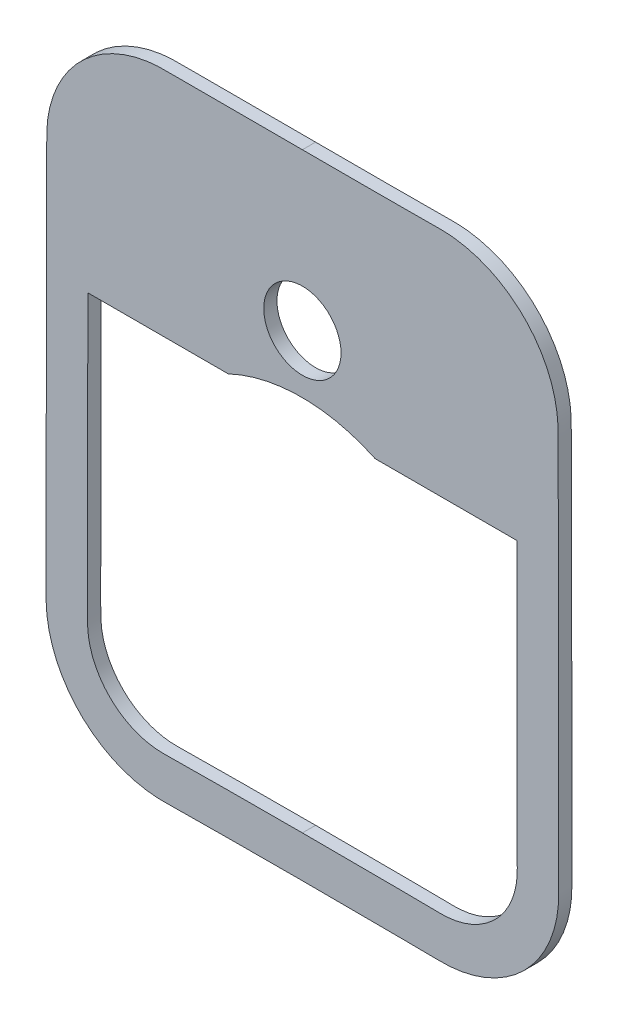
from build123d import *

# Parameters (mm, degrees)
SKETCH_1_R      = 8.2
EXTRUDE_1_DEPTH = 1.4


with BuildPart() as part:
    # Эскиз1 → Бобышка-Вытянуть1 (new, symmetric)
    # profile 1 of 2: a face of its own
    with BuildSketch(Plane.XY):
        with BuildLine():
            add(Edge.make_bspline(
                [(-1.41e-06, 136.904547543), (-2.284548883, 136.89713838), (-6.853789283, 136.88512461), (-13.706881087, 136.887524775), (-19.419454046, 136.900465285), (-23.986387293, 136.921214874), (-26.848187905, 136.929091717), (-29.120285439, 136.954672718), (-31.493604663, 136.906521708), (-34.417255214, 136.50378342), (-37.840149762, 135.546516124), (-42.173876112, 133.638804995), (-47.0147009, 130.136834178), (-50.667775597, 125.412939206), (-52.697786255, 121.129060625), (-53.738103919, 117.727120282), (-54.195277136, 114.810373829), (-54.280191209, 112.427608123), (-54.271144661, 110.157682158), (-54.28922282, 107.293769786), (-54.301107633, 102.726293338), (-54.32071536, 97.011861026), (-54.340105069, 90.156666083), (-54.364049942, 81.015595043), (-54.387501843, 69.589360329), (-54.400781358, 58.162956349), (-54.405864419, 49.022076213), (-54.408185125, 42.166049408), (-54.406005729, 36.453994041), (-54.408858021, 31.881483638), (-54.396585447, 29.030101825), (-54.417722148, 26.734656254), (-54.291980443, 24.360896673), (-53.813331054, 21.446908626), (-52.748869976, 18.052859245), (-50.701910941, 13.780592689), (-47.038208895, 9.066949454), (-42.193333951, 5.581068508), (-37.845983963, 3.693033835), (-34.417769752, 2.757816506), (-31.486111128, 2.381132192), (-29.116899151, 2.352637504), (-26.847434314, 2.393123831), (-23.983553911, 2.414432512), (-19.418308545, 2.459214293), (-13.705824142, 2.495658014), (-6.853673536, 2.523642445), (-2.284462976, 2.524123601), (3.902e-06, 2.52323738)],
                knots=[-1.1821e-05, -1.1821e-05, -1.1821e-05, -1.1821e-05, 0.031238593, 0.062489008, 0.093739422, 0.109364629, 0.124989836, 0.13280244, 0.140615043, 0.15624025, 0.171865457, 0.187490664, 0.218741078, 0.249991493, 0.2656167, 0.281241907, 0.296867114, 0.304679717, 0.312492321, 0.328117528, 0.343742735, 0.374993149, 0.406243563, 0.437493978, 0.499994806, 0.562495634, 0.593746048, 0.624996463, 0.656246877, 0.671872084, 0.687497291, 0.695309894, 0.703122498, 0.718747705, 0.734372912, 0.749998119, 0.781248533, 0.812498948, 0.828124155, 0.843749362, 0.859374569, 0.867187172, 0.874999776, 0.890624983, 0.90625019, 0.937500604, 0.968751018, 1.000001432, 1.000001432, 1.000001432, 1.000001432], degree=3))
            add(Edge.make_bspline(
                [(3.902e-06, 2.52323738), (2.284195851, 2.524145778), (6.852893221, 2.523586), (13.704054168, 2.495781452), (19.416362069, 2.458961502), (23.980091093, 2.414881797), (26.84603811, 2.391979833), (29.109943797, 2.353993451), (31.484249601, 2.380817652), (34.411930196, 2.756774205), (37.842455378, 3.691698887), (42.187718909, 5.578365163), (47.03378736, 9.062318886), (50.69740888, 13.773821034), (52.745986477, 18.044945864), (53.81101385, 21.437961802), (54.290701101, 24.348336193), (54.417560482, 26.725597914), (54.396893213, 29.018944365), (54.409009312, 31.870237315), (54.40584186, 36.442148526), (54.408236551, 42.153558417), (54.405853798, 49.008762573), (54.400756394, 58.148550558), (54.387542668, 69.573602278), (54.364090603, 80.998456779), (54.340155431, 90.138463002), (54.320779487, 96.992787571), (54.301139597, 102.706707695), (54.289432128, 107.273277288), (54.270503636, 110.138004338), (54.281524463, 112.404843612), (54.196813145, 114.788273658), (53.743457029, 117.704753858), (52.705739758, 121.108710825), (50.680586643, 125.392172973), (47.024776798, 130.130747424), (42.168607908, 133.64204219), (37.836569522, 135.547651824), (34.413460001, 136.504929469), (31.490754744, 136.905792277), (29.112807476, 136.956376959), (26.847348354, 136.928076738), (23.982710508, 136.92155454), (19.417623807, 136.900252148), (13.705083837, 136.887594722), (6.853018257, 136.885099848), (2.284274388, 136.897147311), (-1.41e-06, 136.904547543)],
                knots=[-1.433e-06, -1.433e-06, -1.433e-06, -1.433e-06, 0.031248982, 0.062499396, 0.09374981, 0.109375017, 0.125000224, 0.132812828, 0.140625431, 0.156250638, 0.171875845, 0.187501053, 0.218751467, 0.250001881, 0.265627088, 0.281252295, 0.296877502, 0.304690106, 0.312502709, 0.328127917, 0.343753124, 0.375003538, 0.406253952, 0.437504366, 0.500005195, 0.562506023, 0.593756437, 0.625006852, 0.656257266, 0.671882473, 0.68750768, 0.695320284, 0.703132887, 0.718758094, 0.734383301, 0.750008508, 0.781258923, 0.812509337, 0.828134544, 0.843759751, 0.859384958, 0.867197562, 0.875010165, 0.890635372, 0.906260579, 0.937510994, 0.968761408, 1.000011822, 1.000011822, 1.000011822, 1.000011822], degree=3))
        make_face()
        with BuildLine():
            add(Edge.make_bspline(
                [(-45.546100704, 87.83475716), (-45.547611682, 87.263766751), (-45.551581791, 85.740500336), (-45.561086327, 81.933352373), (-45.573492544, 76.413569245), (-45.586012707, 69.562728225), (-45.595448927, 62.711738721), (-45.602042983, 55.860504189), (-45.605985873, 49.008954099), (-45.607444762, 43.298812512), (-45.607492374, 38.730989939), (-45.607275342, 35.875329384), (-45.606707637, 33.592223369), (-45.606026056, 31.880457072), (-45.605553198, 30.445365388), (-45.605757257, 29.311481659), (-45.603532958, 28.46657288), (-45.606795822, 27.529995897), (-45.604488978, 26.893216622), (-45.582244789, 26.315802602), (-45.527587716, 25.562888107), (-45.406627638, 24.61110479), (-45.107128388, 23.116337539), (-44.532893809, 21.288094596), (-43.21017478, 18.529062638), (-40.847134359, 15.489813513), (-37.719561478, 13.240275882), (-34.916519951, 12.023173365), (-33.063554373, 11.516531499), (-31.566443065, 11.274602165), (-30.394818701, 11.168290706), (-29.318242465, 11.153728909), (-27.470666597, 11.183111952), (-25.800006243, 11.197527563), (-23.492298331, 11.221721681), (-20.634803933, 11.247184397), (-17.192179473, 11.273100962), (-12.60930364, 11.300498447), (-6.873193034, 11.32352895), (-2.291707521, 11.324127072), (-3.9021e-05, 11.323238059)],
                knots=[0.416720965, 0.416720965, 0.416720965, 0.416720965, 0.42453243, 0.437560223, 0.468806082, 0.50005194, 0.531297799, 0.562543657, 0.593789515, 0.625035374, 0.640658303, 0.656281232, 0.664092697, 0.671904161, 0.679715626, 0.683621358, 0.687527091, 0.691432823, 0.695338555, 0.699244288, 0.70315002, 0.710961485, 0.718772949, 0.734395878, 0.750018808, 0.781264666, 0.812510524, 0.828133454, 0.843756383, 0.851567848, 0.859379312, 0.867190777, 0.875002241, 0.882813706, 0.890625171, 0.9062481, 0.921871029, 0.937493958, 0.968739817, 0.999985675, 0.999985675, 0.999985675, 0.999985675], degree=3))
            add(Edge.make_bspline(
                [(1.4096e-05, 128.104501314), (-2.290740502, 128.097072123), (-6.871752548, 128.085178437), (-12.60059096, 128.08694214), (-17.181829557, 128.0957399), (-20.617646426, 128.10608411), (-23.479452934, 128.117598931), (-25.770032934, 128.128292772), (-27.199378679, 128.135838193), (-28.347599297, 128.141895979), (-29.19071701, 128.147352306), (-29.823193563, 128.141432826), (-30.331918294, 128.116978675), (-30.938212255, 128.067786124), (-31.690573783, 127.979035498), (-33.02250345, 127.751725567), (-34.877249499, 127.228380645), (-37.688411322, 125.988619168), (-40.821936423, 123.715969871), (-43.170634246, 120.670711555), (-44.468814244, 117.922664951), (-45.023966542, 116.108714676), (-45.270693984, 114.808613996), (-45.369926457, 114.068520608), (-45.4260579, 113.488039214), (-45.459917428, 112.94085237), (-45.470334843, 112.403478275), (-45.472375433, 111.527329039), (-45.476550162, 110.391146619), (-45.481397553, 108.960439841), (-45.489160435, 106.677330111), (-45.498617764, 103.821439657), (-45.50960287, 100.39533521), (-45.522536764, 96.208242339), (-45.533107945, 92.592439196), (-45.541522153, 89.547735571), (-45.544589726, 88.40574757), (-45.546100704, 87.83475716)],
                knots=[0.000118205, 0.000118205, 0.000118205, 0.000118205, 0.031364064, 0.062609922, 0.078232851, 0.09385578, 0.10947871, 0.117290174, 0.125101639, 0.129007371, 0.132913103, 0.136818836, 0.140724568, 0.1446303, 0.148536033, 0.156347497, 0.171970427, 0.187593356, 0.218839214, 0.250085073, 0.265708002, 0.281330931, 0.289142396, 0.293048128, 0.29695386, 0.300859593, 0.304765325, 0.308671057, 0.312576789, 0.320388254, 0.328199719, 0.343822648, 0.359445577, 0.375068506, 0.401098036, 0.4089095, 0.416720965, 0.416720965, 0.416720965, 0.416720965], degree=3))
            add(Edge.make_bspline(
                [(45.546104586, 87.83475716), (45.544593192, 88.405678319), (45.541524701, 89.547527112), (45.53312767, 92.585858308), (45.522579964, 96.195199989), (45.509645571, 100.376049422), (45.49871543, 103.801187969), (45.489279798, 106.658625166), (45.481221854, 108.936137867), (45.476840624, 110.382266936), (45.47209225, 111.488940165), (45.471455529, 112.271626028), (45.466636398, 112.636169822), (45.454369838, 113.016040261), (45.426376284, 113.485017427), (45.372132076, 114.049292757), (45.272575848, 114.797548209), (45.027884397, 116.092247709), (44.473820497, 117.910617547), (43.179236878, 120.655626002), (40.832178522, 123.70977978), (37.679927976, 125.99317268), (34.877229134, 127.228320208), (33.018781335, 127.752507235), (31.500297709, 128.011601546), (30.551288971, 128.106418345), (29.759898954, 128.144003168), (29.242470557, 128.148591247), (28.328673371, 128.14139433), (27.205403996, 128.136100767), (25.763515922, 128.128178402), (23.478789106, 128.117667298), (20.614400517, 128.106045313), (17.180004546, 128.095743416), (12.598957897, 128.08693638), (6.870996672, 128.085175498), (2.290491092, 128.097081094), (1.4096e-05, 128.104501314)],
                knots=[0.583360869, 0.583360869, 0.583360869, 0.583360869, 0.591172333, 0.598983798, 0.624931485, 0.640554414, 0.656177343, 0.671800272, 0.679611737, 0.687423201, 0.691328934, 0.695234666, 0.697187532, 0.699140398, 0.70304613, 0.706951863, 0.710857595, 0.718669059, 0.734291988, 0.749914917, 0.781160775, 0.812406633, 0.828029562, 0.843652491, 0.851463956, 0.85927542, 0.863181152, 0.867086885, 0.870992617, 0.874898349, 0.882709814, 0.890521278, 0.906144207, 0.921767136, 0.937390065, 0.968635923, 0.999881781, 0.999881781, 0.999881781, 0.999881781], degree=3))
            add(Edge.make_bspline(
                [(-3.9021e-05, 11.323238059), (2.291383916, 11.32414933), (6.872478437, 11.323472022), (12.607599735, 11.300593104), (17.190694153, 11.272995363), (20.630445447, 11.247337751), (23.494491472, 11.221361016), (25.501541099, 11.201161232), (26.644451102, 11.189175621), (27.498065116, 11.180275165), (28.352574991, 11.172114392), (29.261509556, 11.159820139), (29.838991381, 11.15885219), (30.595071168, 11.187728461), (31.560099446, 11.273271144), (33.06315948, 11.516547965), (34.911195472, 12.021311999), (37.718171309, 13.239566057), (40.842346722, 15.48484508), (43.20849698, 18.527047098), (44.530333752, 21.281047019), (45.106091164, 23.112408784), (45.405083013, 24.602430564), (45.526723908, 25.554545632), (45.583173633, 26.321035468), (45.60349972, 26.857986736), (45.607093442, 27.542270773), (45.603707768, 28.443123766), (45.605622964, 29.304227651), (45.605661466, 30.433147138), (45.606218842, 31.87044242), (45.606703416, 33.579105551), (45.607198077, 35.864652614), (45.607541123, 38.718514035), (45.607444615, 42.144455486), (45.606848778, 45.569991627), (45.605335547, 50.137378996), (45.602013136, 55.84636726), (45.595459379, 62.696865634), (45.586050356, 69.546914916), (45.57349763, 76.397004549), (45.561116256, 81.922122311), (45.551602677, 85.734771821), (45.547615979, 87.263836002), (45.546104586, 87.83475716)],
                knots=[1.4327e-05, 1.4327e-05, 1.4327e-05, 1.4327e-05, 0.031260185, 0.062506043, 0.078128971, 0.0937519, 0.109374829, 0.117186294, 0.121092026, 0.124997758, 0.128903491, 0.132809223, 0.136714955, 0.140620687, 0.148432152, 0.156243616, 0.171866545, 0.187489474, 0.218735332, 0.24998119, 0.265604119, 0.281227048, 0.289038513, 0.296849977, 0.300755709, 0.304661442, 0.308567174, 0.312472906, 0.316378638, 0.320284371, 0.328095835, 0.3359073, 0.343718764, 0.359341693, 0.374964622, 0.390587551, 0.40621048, 0.437456338, 0.468702196, 0.499948054, 0.531193912, 0.56243977, 0.575549404, 0.583360869, 0.583360869, 0.583360869, 0.583360869], degree=3))
        make_face(mode=Mode.SUBTRACT)
    # profile 2 of 2: a face of its own
    with BuildSketch(Plane.XY):
        with BuildLine():
            add(Edge.make_bspline(
                [(1.4096e-05, 128.104501314), (-2.290740502, 128.097072123), (-6.871752548, 128.085178437), (-12.60059096, 128.08694214), (-17.181829557, 128.0957399), (-20.617646426, 128.10608411), (-23.479452934, 128.117598931), (-25.770032934, 128.128292772), (-27.199378679, 128.135838193), (-28.347599297, 128.141895979), (-29.19071701, 128.147352306), (-29.823193563, 128.141432826), (-30.331918294, 128.116978675), (-30.938212255, 128.067786124), (-31.690573783, 127.979035498), (-33.02250345, 127.751725567), (-34.877249499, 127.228380645), (-37.688411322, 125.988619168), (-40.821936423, 123.715969871), (-43.170634246, 120.670711555), (-44.468814244, 117.922664951), (-45.023966542, 116.108714676), (-45.270693984, 114.808613996), (-45.369926457, 114.068520608), (-45.4260579, 113.488039214), (-45.459917428, 112.94085237), (-45.470334843, 112.403478275), (-45.472375433, 111.527329039), (-45.476550162, 110.391146619), (-45.481397553, 108.960439841), (-45.489160435, 106.677330111), (-45.498617764, 103.821439657), (-45.50960287, 100.39533521), (-45.522536764, 96.208242339), (-45.533107945, 92.592439196), (-45.541522153, 89.547735571), (-45.544589726, 88.40574757), (-45.546100704, 87.83475716)],
                knots=[0.000118205, 0.000118205, 0.000118205, 0.000118205, 0.031364064, 0.062609922, 0.078232851, 0.09385578, 0.10947871, 0.117290174, 0.125101639, 0.129007371, 0.132913103, 0.136818836, 0.140724568, 0.1446303, 0.148536033, 0.156347497, 0.171970427, 0.187593356, 0.218839214, 0.250085073, 0.265708002, 0.281330931, 0.289142396, 0.293048128, 0.29695386, 0.300859593, 0.304765325, 0.308671057, 0.312576789, 0.320388254, 0.328199719, 0.343822648, 0.359445577, 0.375068506, 0.401098036, 0.4089095, 0.416720965, 0.416720965, 0.416720965, 0.416720965], degree=3))
            Line((-45.546100704, 87.83475716), (-15.733857808, 87.83475716))
            ThreePointArc((-15.733857808, 87.83475716), (-0.149929752, 91.33632015), (15.433998304, 87.83475716))
            Line((15.433998304, 87.83475716), (45.546104586, 87.83475716))
            add(Edge.make_bspline(
                [(45.546104586, 87.83475716), (45.544593192, 88.405678319), (45.541524701, 89.547527112), (45.53312767, 92.585858308), (45.522579964, 96.195199989), (45.509645571, 100.376049422), (45.49871543, 103.801187969), (45.489279798, 106.658625166), (45.481221854, 108.936137867), (45.476840624, 110.382266936), (45.47209225, 111.488940165), (45.471455529, 112.271626028), (45.466636398, 112.636169822), (45.454369838, 113.016040261), (45.426376284, 113.485017427), (45.372132076, 114.049292757), (45.272575848, 114.797548209), (45.027884397, 116.092247709), (44.473820497, 117.910617547), (43.179236878, 120.655626002), (40.832178522, 123.70977978), (37.679927976, 125.99317268), (34.877229134, 127.228320208), (33.018781335, 127.752507235), (31.500297709, 128.011601546), (30.551288971, 128.106418345), (29.759898954, 128.144003168), (29.242470557, 128.148591247), (28.328673371, 128.14139433), (27.205403996, 128.136100767), (25.763515922, 128.128178402), (23.478789106, 128.117667298), (20.614400517, 128.106045313), (17.180004546, 128.095743416), (12.598957897, 128.08693638), (6.870996672, 128.085175498), (2.290491092, 128.097081094), (1.4096e-05, 128.104501314)],
                knots=[0.583360869, 0.583360869, 0.583360869, 0.583360869, 0.591172333, 0.598983798, 0.624931485, 0.640554414, 0.656177343, 0.671800272, 0.679611737, 0.687423201, 0.691328934, 0.695234666, 0.697187532, 0.699140398, 0.70304613, 0.706951863, 0.710857595, 0.718669059, 0.734291988, 0.749914917, 0.781160775, 0.812406633, 0.828029562, 0.843652491, 0.851463956, 0.85927542, 0.863181152, 0.867086885, 0.870992617, 0.874898349, 0.882709814, 0.890521278, 0.906144207, 0.921767136, 0.937390065, 0.968635923, 0.999881781, 0.999881781, 0.999881781, 0.999881781], degree=3))
        make_face()
        with Locations((1.4096e-05, 103.636945021)):
            Circle(SKETCH_1_R, mode=Mode.SUBTRACT)
    extrude(amount=EXTRUDE_1_DEPTH, both=True)


solid = part.part
